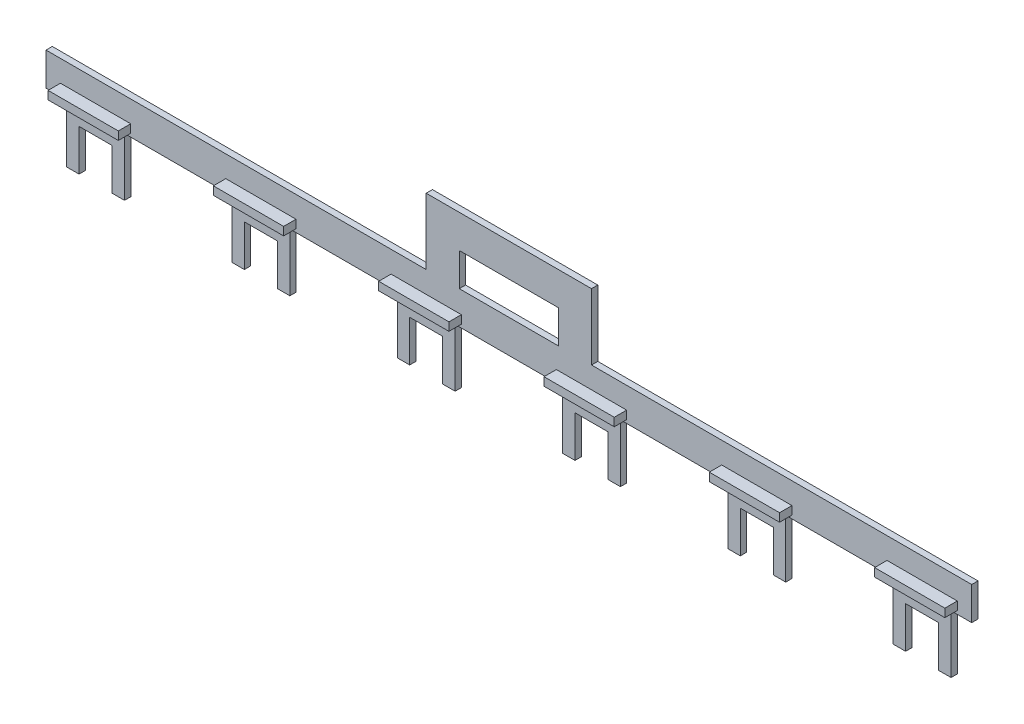
from build123d import *

# Parameters (mm, degrees)
BOSS_EXTRUDE1_DEPTH     = 0.38
BOSS_EXTRUDE2_DEPTH     = 0.38
SKETCH3_W               = 4.25
SKETCH3_H               = 0.5
BOSS_EXTRUDE3_DEPTH     = 0.75
LPATTERN1_COUNT         = 6
LPATTERN1_PITCH         = 10
CUT_EXTRUDE1_DEPTH      = 57.274439135
CUT_EXTRUDE1_DEPTH_BACK = 57.274439135
SKETCH4_W               = 2
SKETCH4_H               = 2.5


with BuildPart() as part:
    # Sketch1 → Boss-Extrude1 (new body)
    with BuildSketch(Plane.XY):
        Polygon((0, 0), (0, -2), (1.25, -2), (1.25, -5.5), (4.75, -5.5), (4.75, -2), (11.25, -2), (11.25, -5.5), (14.75, -5.5), (14.75, -2), (21.25, -2), (21.25, -5.5), (24.75, -5.5), (24.75, -2), (31.25, -2), (31.25, -5.5), (34.75, -5.5), (34.75, -2), (41.25, -2), (41.25, -5.5), (44.75, -5.5), (44.75, -2), (51.25, -2), (51.25, -5.5), (54.75, -5.5), (54.75, -2), (56, -2), (56, 0), align=None)
    extrude(amount=BOSS_EXTRUDE1_DEPTH)

    # Sketch2 → Boss-Extrude2 (add)
    with BuildSketch(Plane.XY.offset(0.38)):
        Polygon((23, 0), (23, 4), (33, 4), (33, 0), (31, 0), (31, 2), (25, 2), (25, 0), align=None)
    extrude(amount=-BOSS_EXTRUDE2_DEPTH)

    # Sketch3 → Boss-Extrude3 (add)
    with BuildSketch(Plane.XY.offset(0.38)):
        with Locations((3, -1.55)):
            Rectangle(SKETCH3_W, SKETCH3_H)
    boss_extrude3 = extrude(amount=BOSS_EXTRUDE3_DEPTH)

    # LPattern1: Boss-Extrude3 ×6
    with Locations(*[(i * LPATTERN1_PITCH, 0, 0) for i in range(1, LPATTERN1_COUNT)]):
        add(boss_extrude3)

    # Sketch4 → Cut-Extrude1 (cut, two sides: drawn at the far end of the back side and taken through both)
    with BuildSketch(Plane.XY.offset(0.38).offset(-CUT_EXTRUDE1_DEPTH_BACK)):
        with Locations((3, -4.25)):
            Rectangle(SKETCH4_W, SKETCH4_H)
        with Locations((13, -4.25)):
            Rectangle(SKETCH4_W, SKETCH4_H)
        with Locations((23, -4.25)):
            Rectangle(SKETCH4_W, SKETCH4_H)
        with Locations((33, -4.25)):
            Rectangle(SKETCH4_W, SKETCH4_H)
        with Locations((43, -4.25)):
            Rectangle(SKETCH4_W, SKETCH4_H)
        with Locations((53, -4.25)):
            Rectangle(SKETCH4_W, SKETCH4_H)
    extrude(amount=CUT_EXTRUDE1_DEPTH + CUT_EXTRUDE1_DEPTH_BACK, mode=Mode.SUBTRACT)


solid = part.part
